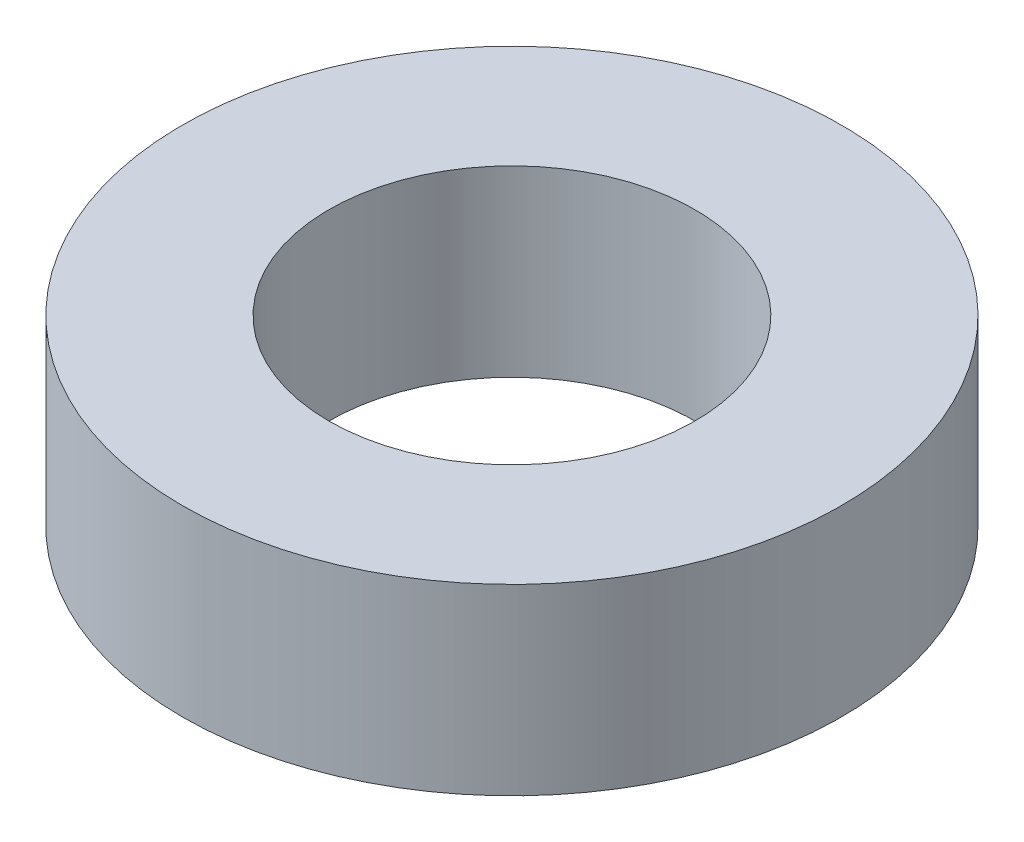
from build123d import *

# Parameters (mm, degrees)
SKETCH1_R           = 4.5
SKETCH1_R_2         = 2.5
BOSS_EXTRUDE1_DEPTH = 2.5


with BuildPart() as part:
    # Sketch1 → Boss-Extrude1 (new body)
    with BuildSketch(Plane(origin=(0, 0, 0), x_dir=(1, 0, 0), z_dir=(0, 1, 0))):
        with Locations(Location((0, 0, 0), (0, 0, 270))):
            Circle(SKETCH1_R)
        with Locations(Location((0, 0, 0), (0, 0, 270))):
            Circle(SKETCH1_R_2, mode=Mode.SUBTRACT)
    extrude(amount=BOSS_EXTRUDE1_DEPTH)


solid = part.part
